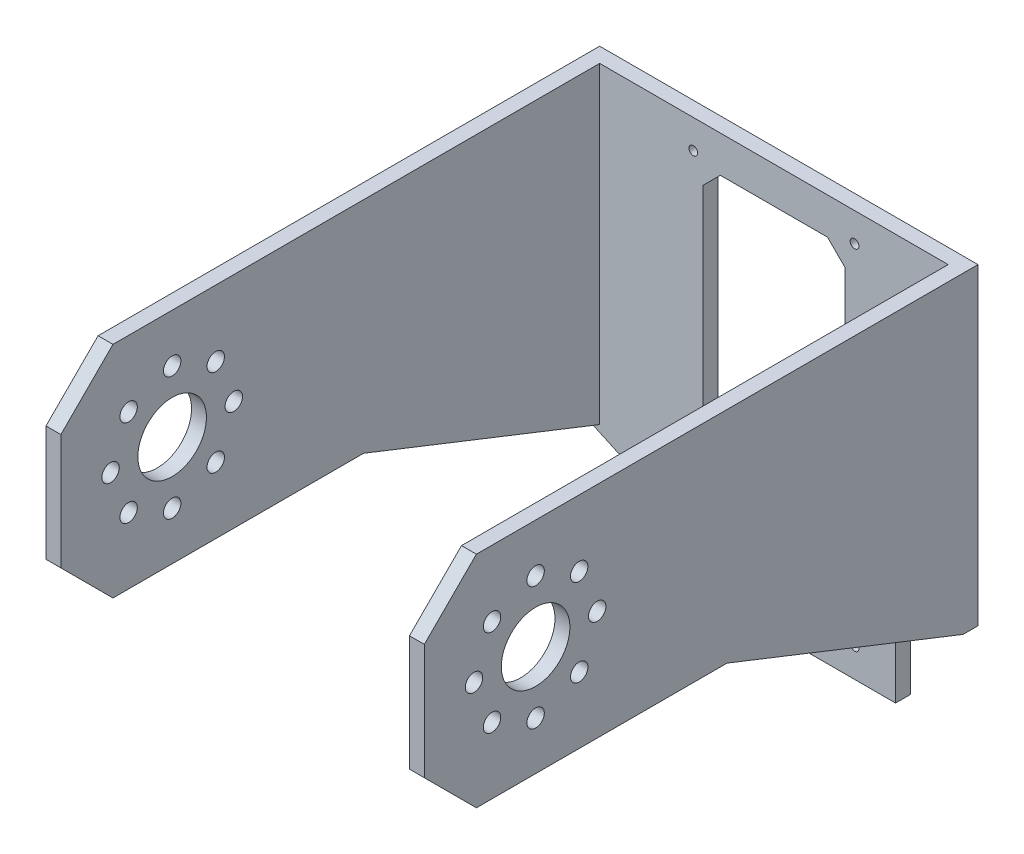
from build123d import *

# Parameters (mm, degrees)
BOSS_EXTRUDE1_DEPTH = 12.605
CUT_EXTRUDE1_DEPTH  = 32.2
SKETCH3_R           = 3.935
SKETCH3_R_2         = 1
CUT_EXTRUDE2_DEPTH  = 32.2
BOSS_EXTRUDE2_DEPTH = 21.39
SKETCH6_R           = 0.5
SKETCH6_W           = 16.3
SKETCH6_H           = 38.2
CUT_EXTRUDE4_DEPTH  = 45
CUT_EXTRUDE5_DEPTH  = 68
CHAMFER3_SIZE       = 2


with BuildPart() as part:
    # Sketch1 → Boss-Extrude1 (new, symmetric)
    with BuildSketch(Plane(origin=(0, 0, 0), x_dir=(1, 0, 0), z_dir=(0, 1, 0))):
        Polygon((0, 0), (-21.71, 0), (-21.71, -63.54), (-20, -63.54), (-20, -1.71), (0, -1.71), align=None)
    boss_extrude1 = extrude(amount=BOSS_EXTRUDE1_DEPTH, both=True)

    # Sketch2 → Cut-Extrude1 (cut)
    with BuildSketch(Plane.ZY.offset(21.71)):
        Polygon((57.565, 12.605), (63.54, 6.63), (63.54, 12.605), align=None)
        Polygon((63.54, -6.63), (57.565, -12.605), (63.54, -12.605), align=None)
    cut_extrude1 = extrude(amount=-CUT_EXTRUDE1_DEPTH, mode=Mode.SUBTRACT)

    # Sketch3 → Cut-Extrude2 (cut)
    with BuildSketch(Plane.ZY.offset(21.71)):
        with Locations((50.77, 0)):
            Circle(SKETCH3_R)
        with Locations((45.77, 5)):
            Circle(SKETCH3_R_2)
        with Locations((55.77, 5)):
            Circle(SKETCH3_R_2)
        with Locations((55.77, -5)):
            Circle(SKETCH3_R_2)
        with Locations((45.77, -5)):
            Circle(SKETCH3_R_2)
        with Locations((43.698932188, 0)):
            Circle(SKETCH3_R_2)
        with Locations((50.77, -7.071067812)):
            Circle(SKETCH3_R_2)
        with Locations((57.841067812, 0)):
            Circle(SKETCH3_R_2)
        with Locations((50.77, 7.071067812)):
            Circle(SKETCH3_R_2)
    cut_extrude2 = extrude(amount=-CUT_EXTRUDE2_DEPTH, mode=Mode.SUBTRACT)

    # Mirror1: Boss-Extrude1, Cut-Extrude1, Cut-Extrude2 across plane
    add(boss_extrude1.mirror(Plane(origin=(0, 12.605, 1.71), x_dir=(0, 0, 1), z_dir=(-1, 0, 0))))
    add(cut_extrude1.mirror(Plane(origin=(0, 12.605, 1.71), x_dir=(0, 0, 1), z_dir=(-1, 0, 0))), mode=Mode.SUBTRACT)
    add(cut_extrude2.mirror(Plane(origin=(0, 12.605, 1.71), x_dir=(0, 0, 1), z_dir=(-1, 0, 0))), mode=Mode.SUBTRACT)

    # Sketch5 → Boss-Extrude2 (add)
    with BuildSketch(Plane.XZ.offset(12.605)):
        Polygon((-21.71, 28.8), (-20, 28.8), (-20, 1.71), (20, 1.71), (20, 28.8), (21.71, 28.8), (21.71, 0), (-21.71, 0), align=None)
    extrude(amount=BOSS_EXTRUDE2_DEPTH)

    # Sketch6 → Cut-Extrude4 (cut)
    with BuildSketch(Plane(origin=(0, 0, 0), x_dir=(-1, 0, 0), z_dir=(0, 0, -1))):
        with Locations((-9.25, 9.305)):
            Circle(SKETCH6_R)
        with Locations((9.25, 9.305)):
            Circle(SKETCH6_R)
        with Locations((9.25, -30.695)):
            Circle(SKETCH6_R)
        with Locations((-9.25, -30.695)):
            Circle(SKETCH6_R)
        Polygon((-21.71, -26.845), (-21.71, -33.995), (-13.96, -33.995), (-13.96, -26.845), (-21.71, -23.295), align=None)
        Polygon((21.71, -23.295), (13.96, -26.845), (13.96, -33.995), (21.71, -33.995), (21.71, -26.845), align=None)
        with Locations((0, -10.695)):
            Rectangle(SKETCH6_W, SKETCH6_H)
    extrude(amount=-CUT_EXTRUDE4_DEPTH, mode=Mode.SUBTRACT)

    # Sketch7 → Cut-Extrude5 (cut)
    with BuildSketch(Plane(origin=(21.71, 0, 0), x_dir=(0, 0, -1), z_dir=(1, 0, 0))):
        Polygon((-28.8, -12.605), (-1.71, -23.295), (-1.71, -35.593839202), (-28.8, -35.593839202), align=None)
    extrude(amount=-CUT_EXTRUDE5_DEPTH, mode=Mode.SUBTRACT)

    # Chamfer3
    chamfer3_edges = [part.edges().sort_by_distance(p)[0] for p in [
        (-8.15, 8.405, 0.855),
        (-8.15, -29.795, 0.855),
        (8.15, -29.795, 0.855),
        (8.15, 8.405, 0.855),
    ]]
    chamfer(chamfer3_edges, length=CHAMFER3_SIZE)


solid = part.part
